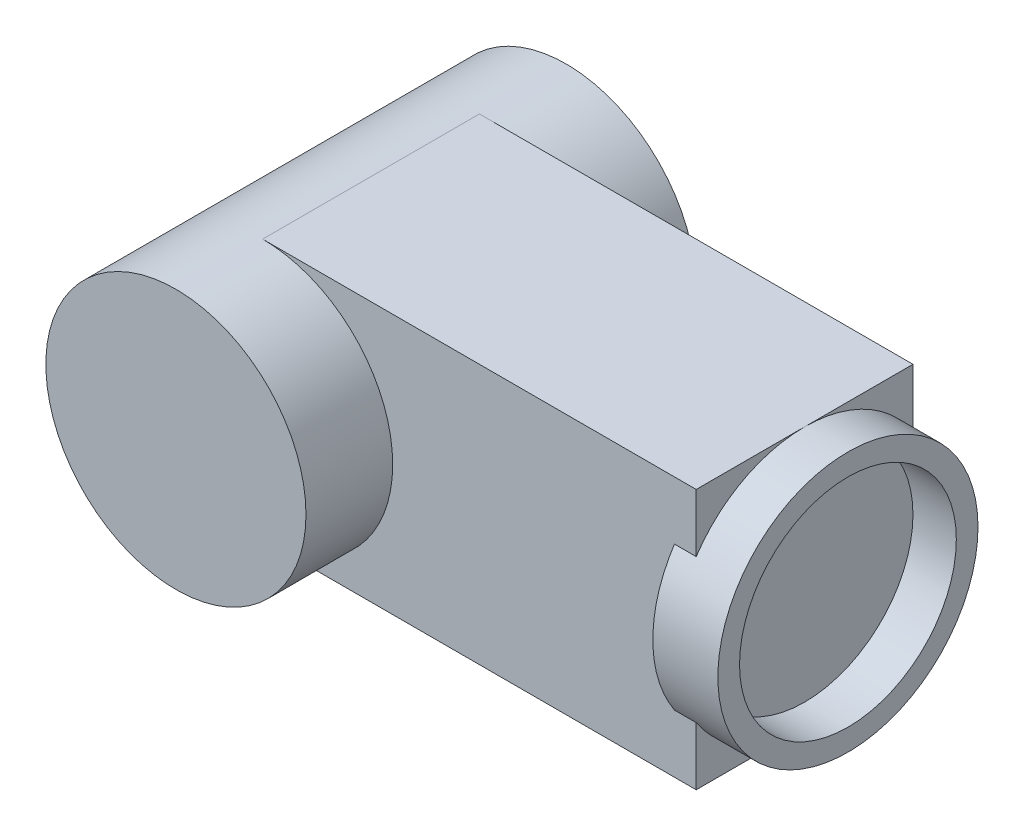
from build123d import *

# Parameters (mm, degrees)
SKETCH3_W                = 100
SKETCH3_H                = 60
BOSS_EXTRUDE3_DEPTH      = 25
SKETCH4_R                = 30
BOSS_EXTRUDE5_DEPTH      = 45
BOSS_EXTRUDE9_DEPTH      = 10
BOSS_EXTRUDE9_DEPTH_BACK = 5


with BuildPart() as part:
    # Sketch3 → Boss-Extrude3 (new, symmetric)
    with BuildSketch(Plane.XY):
        Rectangle(SKETCH3_W, SKETCH3_H)
    extrude(amount=BOSS_EXTRUDE3_DEPTH, both=True)

    # Sketch4 → Boss-Extrude5 (add, symmetric)
    with BuildSketch(Plane.XY):
        with Locations((-50, 0)):
            Circle(SKETCH4_R)
    extrude(amount=BOSS_EXTRUDE5_DEPTH, both=True)

    # Sketch5 → Boss-Extrude9 (add, two sides: drawn at the far end of the back side and taken through both)
    with BuildSketch(Plane(origin=(50, 0, 0), x_dir=(0, 0, -1), z_dir=(1, 0, 0)).offset(-BOSS_EXTRUDE9_DEPTH_BACK)):
        with BuildLine():
            Line((-25, 2.6e-08), (-25, 16.583123952))
            ThreePointArc((-25, 16.583123952), (-30, 0), (-25, -16.583123952))
            Line((-25, -16.583123952), (-25, 2.6e-08))
        make_face()
        with BuildLine():
            Line((25, 0), (25, 16.583123952))
            ThreePointArc((25, 16.583123952), (0, 30), (-25, 16.583123952))
            Line((-25, 16.583123952), (-25, 2.6e-08))
            ThreePointArc((-25, 2.6e-08), (1.3e-08, 25), (25, 0))
        make_face()
        with BuildLine():
            ThreePointArc((-25, -16.583123952), (0, -30), (25, -16.583123952))
            Line((25, -16.583123952), (25, 0))
            ThreePointArc((25, 0), (-1.3e-08, -25), (-25, 2.6e-08))
            Line((-25, 2.6e-08), (-25, -16.583123952))
        make_face()
        with BuildLine():
            ThreePointArc((25, -16.583123952), (28.722813233, -8.660254038), (30, 0))
            ThreePointArc((30, 0), (28.722813233, 8.660254038), (25, 16.583123952))
            Line((25, 16.583123952), (25, 0))
            Line((25, 0), (25, -16.583123952))
        make_face()
    extrude(amount=BOSS_EXTRUDE9_DEPTH + BOSS_EXTRUDE9_DEPTH_BACK)


solid = part.part
